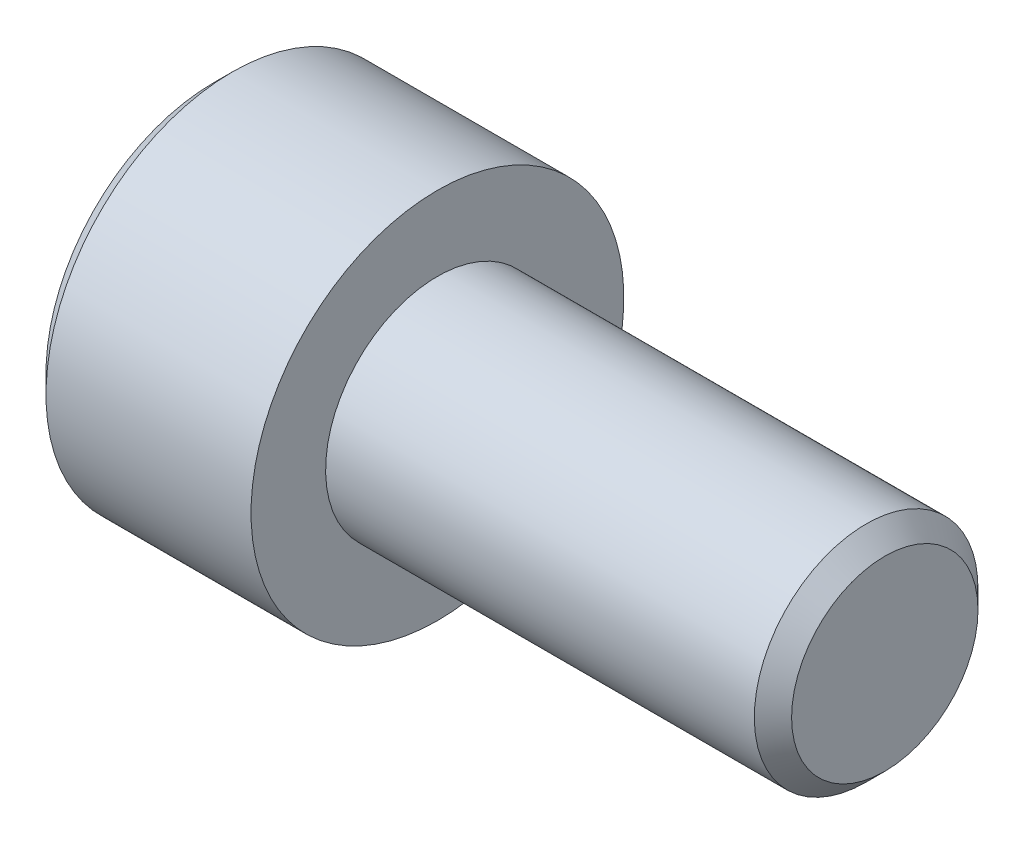
from build123d import *

# Parameters (mm, degrees)
CUT_EXTRUDE1_DEPTH = 3
CHAMFER1_SIZE      = 0.5


with BuildPart() as part:
    # Sketch1 → Revolve1 (revolve)
    with BuildSketch(Plane.XY, mode=Mode.PRIVATE) as revolve1_sk:
        Polygon((-6, 0), (-6, 5), (0, 5), (0, 3), (12, 3), (12, 0), align=None)
    revolve(revolve1_sk.sketch.rotate(Axis((12, 0, 0), (-1, 0, 0)), 180), axis=Axis((12, 0, 0), (-1, 0, 0)))

    # Sketch2 → Cut-Revolve1 (revolve, cut)
    with BuildSketch(Plane.XY, mode=Mode.PRIVATE) as cut_revolve1_sk:
        Polygon((-6, 0), (-6, 2.495), (-3, 2.495), (-2.331466765, 0), align=None)
    revolve(cut_revolve1_sk.sketch.rotate(Axis((-2.331466765, 0, 0), (-1, 0, 0)), 270), axis=Axis((-2.331466765, 0, 0), (-1, 0, 0)), mode=Mode.SUBTRACT)

    # Sketch3 → Cut-Extrude1 (cut)
    with BuildSketch(Plane.ZY.offset(6)):
        Polygon((0, 2.886751346), (-2.5, 1.443375673), (-2.5, -1.443375673), (0, -2.886751346), (2.5, -1.443375673), (2.5, 1.443375673), align=None)
    extrude(amount=-CUT_EXTRUDE1_DEPTH, mode=Mode.SUBTRACT)

    # Chamfer1
    chamfer1_edges = [part.edges().sort_by_distance(p)[0] for p in [
        (12, 3, 0),
        (-6, 5, 0),
    ]]
    chamfer(chamfer1_edges, length=CHAMFER1_SIZE)


solid = part.part
